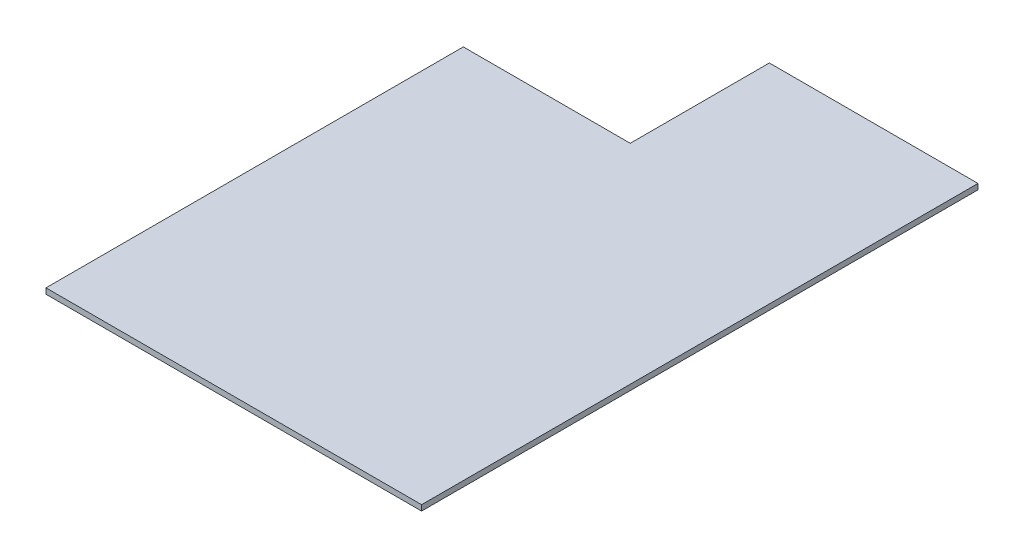
from build123d import *

# Parameters (mm, degrees)
BOSS_EXTRUDE1_DEPTH = 0.508


with BuildPart() as part:
    # Sketch1 → Boss-Extrude1 (new body)
    with BuildSketch(Plane(origin=(0, 0, 0), x_dir=(1, 0, 0), z_dir=(0, 1, 0))):
        Polygon((0, 0), (34.29, 0), (34.29, 50.8), (15.24, 50.8), (15.24, 38.1), (0, 38.1), align=None)
    extrude(amount=BOSS_EXTRUDE1_DEPTH)


solid = part.part
